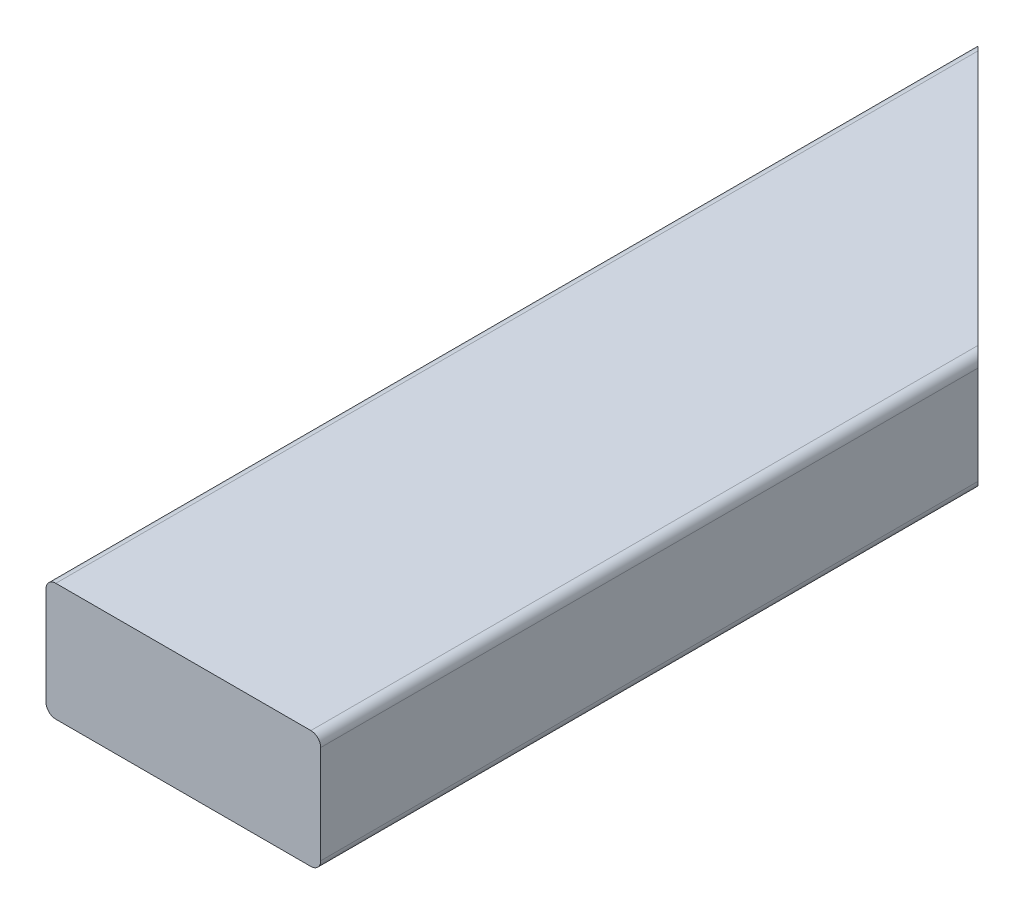
from build123d import *

# Parameters (mm, degrees)
BOSS_EXTRUDE1_DEPTH = 38.1
FILLET1_R           = 3.175


with BuildPart() as part:
    # Sketch1 → Boss-Extrude1 (new body)
    with BuildSketch(Plane(origin=(0, 0, 0), x_dir=(1, 0, 0), z_dir=(0, 1, 0))):
        Polygon((0, 0), (-88.9, 88.9), (-88.9, -212.725), (0, -212.725), align=None)
    extrude(amount=BOSS_EXTRUDE1_DEPTH)

    # Fillet1
    fillet1_edges = [part.edges().sort_by_distance(p)[0] for p in [
        (-88.9, 38.1, 61.9125),
        (0, 38.1, 106.3625),
        (-88.9, 0, 61.9125),
        (0, 0, 106.3625),
    ]]
    fillet(fillet1_edges, radius=FILLET1_R)


solid = part.part
